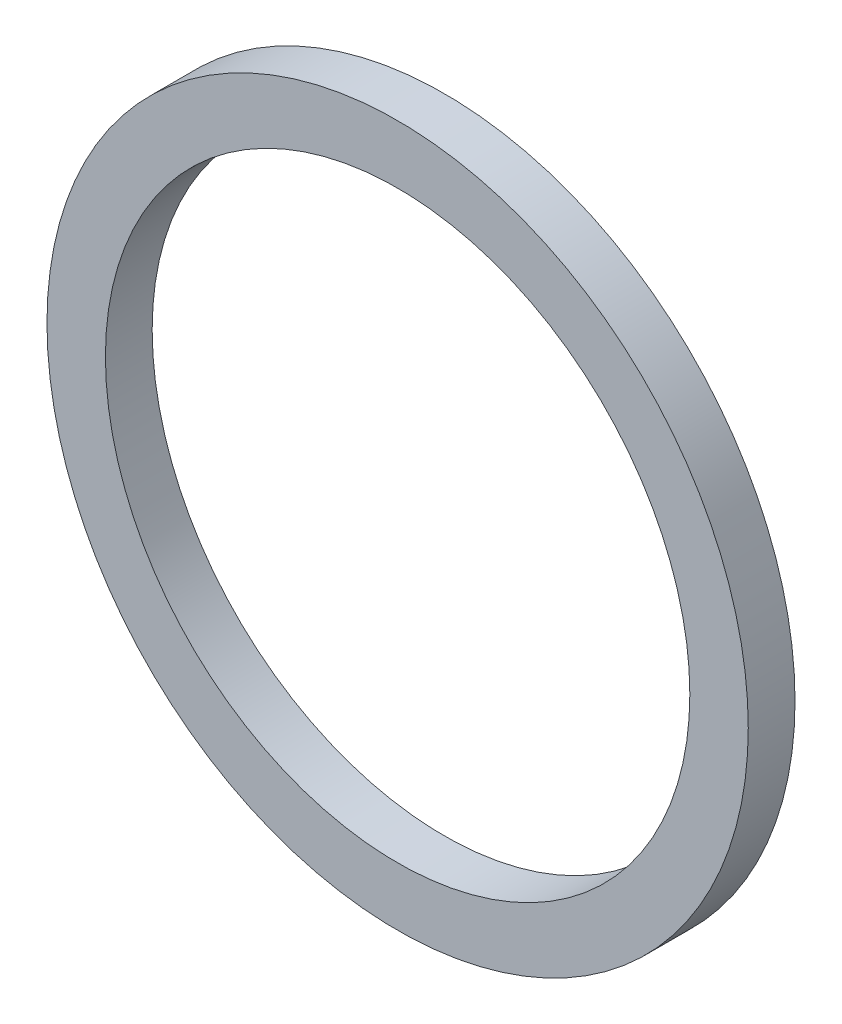
from build123d import *

# Parameters (mm, degrees)
SKICA1_R                = 6
SKICA1_R_2              = 5
P_IDAT_VYSUNUT_M1_DEPTH = 0.8


with BuildPart() as part:
    # Skica1 → Přidat vysunutím1 (new body)
    with BuildSketch(Plane.XY):
        Circle(SKICA1_R)
        Circle(SKICA1_R_2, mode=Mode.SUBTRACT)
    extrude(amount=P_IDAT_VYSUNUT_M1_DEPTH)


solid = part.part
